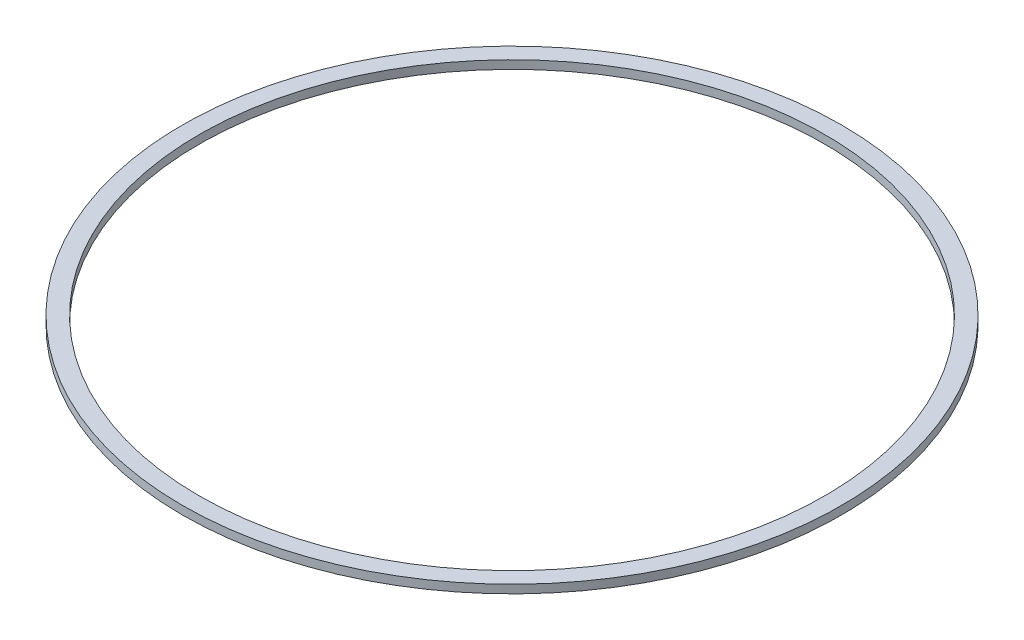
from build123d import *

# Parameters (mm, degrees)
SKETCH1_R           = 250.825
SKETCH1_R_2         = 238.125
BOSS_EXTRUDE1_DEPTH = 6.35


with BuildPart() as part:
    # Sketch1 → Boss-Extrude1 (new body)
    with BuildSketch(Plane(origin=(0, 0, 0), x_dir=(1, 0, 0), z_dir=(0, 1, 0))):
        with Locations(Location((0, 0, 0), (0, 0, 270))):
            Circle(SKETCH1_R)
        with Locations(Location((0, 0, 0), (0, 0, 270))):
            Circle(SKETCH1_R_2, mode=Mode.SUBTRACT)
    extrude(amount=BOSS_EXTRUDE1_DEPTH)


solid = part.part
